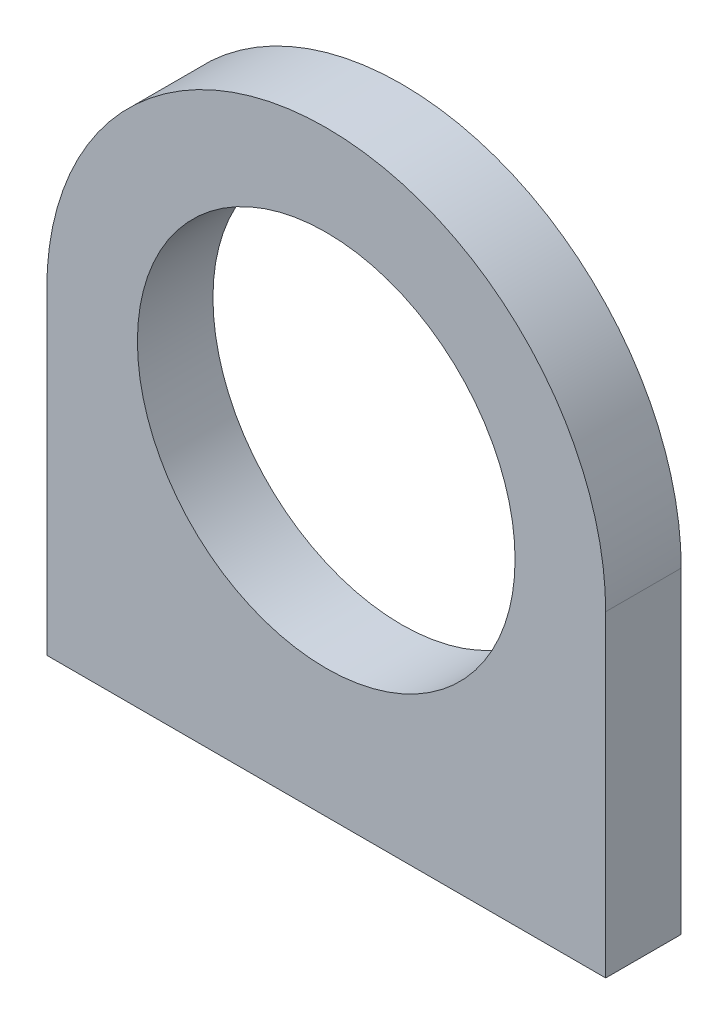
from build123d import *

# Parameters (mm, degrees)
BOSS_EXTRUDE1_DEPTH      = 2.5
BOSS_EXTRUDE1_DEPTH_BACK = 2.5
SKETCH1_R                = 12.5
SKETCH2_R                = 1.5
CUT_EXTRUDE1_DEPTH       = 10


with BuildPart() as part:
    # Sketch1 → Boss-Extrude1 (new, two sides: drawn at the far end of the back side and taken through both)
    with BuildSketch(Plane.XY.offset(-BOSS_EXTRUDE1_DEPTH_BACK)):
        with BuildLine():
            Line((18.5, -21), (18.5, 0))
            ThreePointArc((18.5, 0), (0, 18.5), (-18.5, 0))
            Line((-18.5, 0), (-18.5, -21))
            Line((-18.5, -21), (18.5, -21))
        make_face()
        Circle(SKETCH1_R, mode=Mode.SUBTRACT)
    extrude(amount=BOSS_EXTRUDE1_DEPTH + BOSS_EXTRUDE1_DEPTH_BACK)

    # Sketch2 → Cut-Extrude1 (cut)
    with BuildSketch(Plane.XZ.offset(21)):
        with Locations((-16, 0)):
            Circle(SKETCH2_R)
    cut_extrude1 = extrude(amount=-CUT_EXTRUDE1_DEPTH, mode=Mode.SUBTRACT)

    # Mirror1: Cut-Extrude1 across plane
    add(cut_extrude1.mirror(Plane(origin=(0, 0, 0), x_dir=(0, 0, 1), z_dir=(1, 0, 0))), mode=Mode.SUBTRACT)


solid = part.part
